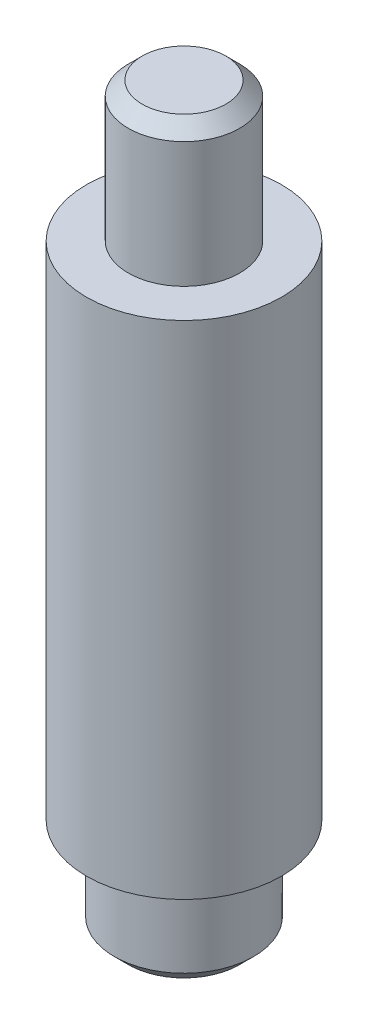
from build123d import *


with BuildPart() as part:
    # Esquisse2 → Base-Révolution (revolve)
    with BuildSketch(Plane(origin=(0, 0, 0), x_dir=(0, 0, -1), z_dir=(1, 0, 0)), mode=Mode.PRIVATE) as base_r_volution_sk:
        Polygon((0, 1), (-4, 1), (-5, 2), (-5, 8), (-7, 8), (-7, 44), (-4, 44), (-4, 53), (-3, 54), (0, 54), align=None)
    revolve(base_r_volution_sk.sketch.rotate(Axis((0, 0, 0), (0, 1, 0)), 180), axis=Axis((0, 0, 0), (0, 1, 0)))


solid = part.part
